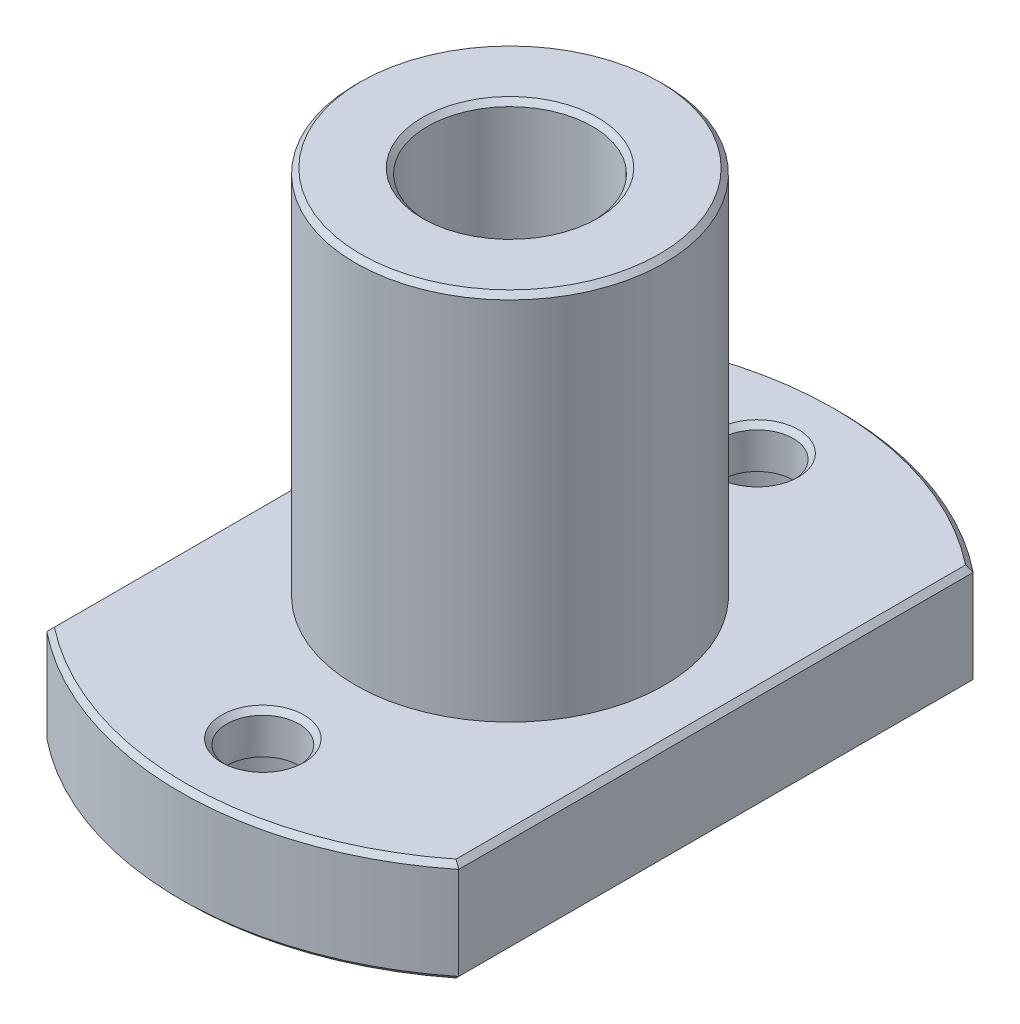
from build123d import *

# Parameters (mm, degrees)
SKETCH1_R           = 16
BOSS_EXTRUDE1_DEPTH = 5
CUT_EXTRUDE1_DEPTH  = 5
SKETCH3_R           = 7.5
BOSS_EXTRUDE2_DEPTH = 18
SKETCH4_R           = 4
CUT_EXTRUDE2_DEPTH  = 23
SKETCH5_R           = 1.75
CUT_EXTRUDE3_DEPTH  = 5
SKETCH6_R           = 3
CUT_EXTRUDE4_DEPTH  = 3
CHAMFER1_SIZE       = 0.25


with BuildPart() as part:
    # Sketch1 → Boss-Extrude1 (new body)
    with BuildSketch(Plane(origin=(0, 0, 0), x_dir=(1, 0, 0), z_dir=(0, 1, 0))):
        with Locations(Location((0, 0, 0), (0, 0, 270))):
            Circle(SKETCH1_R)
    extrude(amount=BOSS_EXTRUDE1_DEPTH)

    # Sketch2 → Cut-Extrude1 (cut)
    with BuildSketch(Plane(origin=(0, 0, 0), x_dir=(1, 0, 0), z_dir=(0, 1, 0))):
        with BuildLine():
            Line((-10, 12.489995997), (-10, -12.489995997))
            ThreePointArc((-10, -12.489995997), (-16, 0), (-10, 12.489995997))
        make_face()
        with BuildLine():
            Line((10, 12.489995997), (10, -12.489995997))
            ThreePointArc((10, -12.489995997), (16, 0), (10, 12.489995997))
        make_face()
    extrude(amount=CUT_EXTRUDE1_DEPTH, mode=Mode.SUBTRACT)

    # Sketch3 → Boss-Extrude2 (add)
    with BuildSketch(Plane(origin=(0, 5, 0), x_dir=(1, 0, 0), z_dir=(0, 1, 0))):
        with Locations(Location((0, 0, 0), (0, 0, 270))):
            Circle(SKETCH3_R)
    extrude(amount=BOSS_EXTRUDE2_DEPTH)

    # Sketch4 → Cut-Extrude2 (cut)
    with BuildSketch(Plane(origin=(0, 23, 0), x_dir=(1, 0, 0), z_dir=(0, 1, 0))):
        with Locations(Location((0, 0, 0), (0, 0, 270))):
            Circle(SKETCH4_R)
    extrude(amount=-CUT_EXTRUDE2_DEPTH, mode=Mode.SUBTRACT)

    # Sketch5 → Cut-Extrude3 (cut)
    with BuildSketch(Plane(origin=(0, 5, 0), x_dir=(1, 0, 0), z_dir=(0, 1, 0))):
        with Locations(Location((0, 12, 0), (0, 0, 270))):
            Circle(SKETCH5_R)
        with Locations(Location((0, -12, 0), (0, 0, 270))):
            Circle(SKETCH5_R)
    extrude(amount=-CUT_EXTRUDE3_DEPTH, mode=Mode.SUBTRACT)

    # Sketch6 → Cut-Extrude4 (cut)
    with BuildSketch(Plane.XZ):
        with Locations(Location((0, 12, 0), (0, 0, 270))):
            Circle(SKETCH6_R)
        with Locations(Location((0, -12, 0), (0, 0, 270))):
            Circle(SKETCH6_R)
    extrude(amount=-CUT_EXTRUDE4_DEPTH, mode=Mode.SUBTRACT)

    # Chamfer1
    chamfer1_edges = [part.edges().sort_by_distance(p)[0] for p in [
        (0, 0, -16),
        (0, 5, -16),
        (10, 0, 0),
        (10, 5, 0),
        (0, 23, -7.5),
        (0, 0, -4),
        (0, 23, -4),
        (0, 5, -13.75),
        (0, 5, 10.25),
        (0, 0, 15),
        (0, 0, -9),
        (0, 0, 16),
        (0, 5, 16),
        (-10, 0, 0),
        (-10, 5, 0),
    ]]
    chamfer(chamfer1_edges, length=CHAMFER1_SIZE)


solid = part.part
